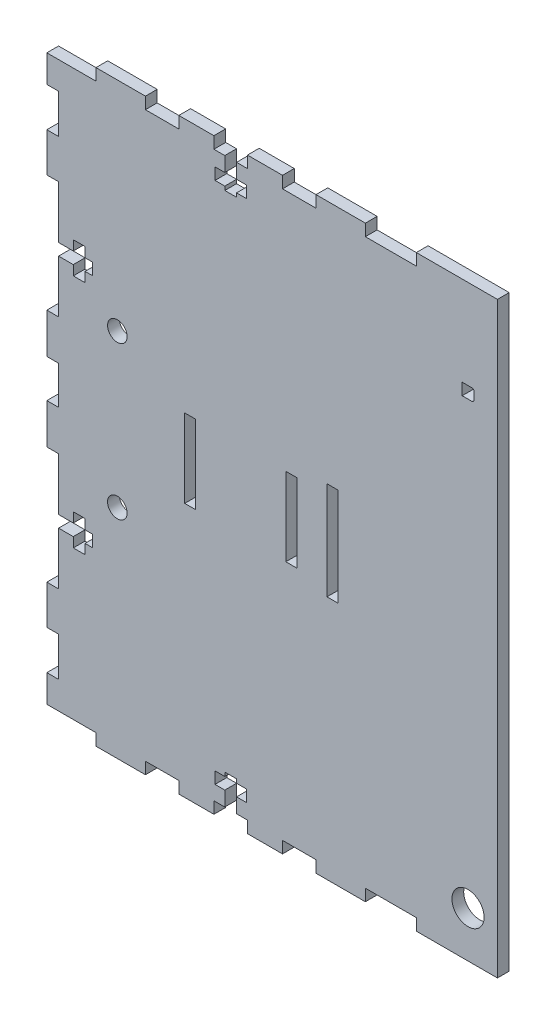
from build123d import *

# Parameters (mm, degrees)
SALIENTE_EXTRUIR1_DEPTH = 1.5
CROQUIS2_W              = 2.8
CROQUIS2_H              = 20
CROQUIS2_R              = 2.5
CORTAR_EXTRUIR1_DEPTH   = 11
CROQUIS4_W              = 2.8
CROQUIS4_H              = 25
CORTAR_EXTRUIR3_DEPTH   = 13
CROQUIS5_W              = 3
CROQUIS5_H              = 144.0002072
SALIENTE_EXTRUIR2_DEPTH = 15
CROQUIS6_R              = 4.1
CORTAR_EXTRUIR4_DEPTH   = 15
CROQUIS7_W              = 20.699997517
CROQUIS7_H              = 3
SALIENTE_EXTRUIR3_DEPTH = 3
CROQUIS8_W              = 20.699997553
CROQUIS8_H              = 3
SALIENTE_EXTRUIR4_DEPTH = 3


with BuildPart() as part:
    # Croquis1 → Saliente-Extruir1 (new, symmetric)
    with BuildSketch(Plane.XY):
        Polygon((419.401663173, 255.63715478), (419.401663173, 248.637154823), (431.940346335, 248.637154823), (431.940346335, 245.637154782), (444.561007707, 245.63714943), (444.561007707, 248.637149514), (453.092348458, 248.637149514), (453.092348458, 245.637149514), (462.042348456, 245.637149514), (462.042348456, 248.637116576), (464.821999726, 248.637116576), (464.821999726, 252.386767599), (462.321999727, 252.386767599), (462.321999727, 255.387116575), (464.821999726, 255.387116575), (464.821999726, 256.362116575), (467.821999725, 256.362116575), (467.821999725, 255.387116575), (470.322418497, 255.387116575), (470.322418497, 252.386767599), (467.821999725, 252.386767599), (467.821999725, 248.637116576), (470.601650995, 248.637116576), (470.601650995, 245.637116577), (479.551650993, 245.637116577), (479.551650993, 248.637039563), (488.101650991, 248.637039563), (488.101650991, 245.637039564), (500.701660131, 245.637039564), (500.701660131, 248.637051166), (519.401657648, 248.637051166), (519.401657648, 392.637258366), (500.701660095, 392.637258366), (500.701660095, 395.637269968), (488.101650956, 395.637269968), (488.101650956, 392.637269969), (479.551650957, 392.637269969), (479.551650957, 395.637192955), (470.601650959, 395.637192955), (470.601650959, 392.637192956), (467.82199969, 392.637192956), (467.82199969, 388.887541933), (470.322418461, 388.887541933), (470.322418461, 385.887192957), (467.82199969, 385.887192957), (467.82199969, 384.912192957), (464.82199969, 384.912192957), (464.82199969, 385.887192957), (462.321999691, 385.887192957), (462.321999691, 388.887541933), (464.82199969, 388.887541933), (464.82199969, 392.637192956), (462.04234842, 392.637192956), (462.04234842, 395.637160018), (453.092348422, 395.637160018), (453.092348422, 392.637160018), (444.561007671, 392.637160018), (444.561007671, 395.637160103), (431.9403463, 395.637154751), (431.9403463, 392.637154709), (419.401663173, 392.637154709), (419.401663173, 385.637154752), (422.401663173, 385.637154752), (422.401663173, 375.637154754), (419.401663173, 375.637154754), (419.401663173, 365.637154757), (422.401663173, 365.637154757), (422.401663173, 352.199445373), (426.151314195, 352.199445373), (426.151314195, 354.699864145), (429.151663171, 354.699864145), (429.151663171, 352.199445373), (431.101663171, 352.199445373), (431.101663171, 349.199445374), (429.151663171, 349.199445374), (429.151663171, 346.699445374), (426.151314195, 346.699445374), (426.151314195, 349.199445374), (422.401663173, 349.199445374), (422.401663173, 335.762154763), (419.401663173, 335.762154763), (419.401663173, 325.512154765), (422.401663173, 325.512154765), (422.401663173, 315.762154767), (419.401663173, 315.762154767), (419.401663173, 305.512154769), (422.401663173, 305.512154769), (422.401663173, 292.074445386), (426.151314195, 292.074445386), (426.151314195, 294.574864158), (429.151663171, 294.574864158), (429.151663171, 292.074445386), (431.101663171, 292.074445386), (431.101663171, 289.074445387), (429.151663171, 289.074445387), (429.151663171, 286.574445387), (426.151314195, 286.574445387), (426.151314195, 289.074445387), (422.401663173, 289.074445387), (422.401663173, 275.637154776), (419.401663173, 275.637154776), (419.401663173, 265.637154778), (422.401663173, 265.637154778), (422.401663173, 255.63715478), align=None)
    extrude(amount=SALIENTE_EXTRUIR1_DEPTH, both=True)

    # Croquis2 → Cortar-Extruir1 (cut)
    with BuildSketch(Plane.XY.offset(1.5)):
        with Locations((481.801663173, 320.637154766)):
            Rectangle(CROQUIS2_W, CROQUIS2_H)
        with Locations((456.001663173, 320.637154766)):
            Rectangle(CROQUIS2_W, CROQUIS2_H)
        with Locations((437.401663173, 340.137154766)):
            Circle(CROQUIS2_R)
        with Locations((437.401663173, 301.137154766)):
            Circle(CROQUIS2_R)
    extrude(amount=-CORTAR_EXTRUIR1_DEPTH, mode=Mode.SUBTRACT)

    # Croquis4 → Cortar-Extruir3 (cut)
    with BuildSketch(Plane(origin=(0, 0, -1.5), x_dir=(-1, 0, 0), z_dir=(0, 0, -1))):
        with Locations((-492.30166041, 320.637154766)):
            Rectangle(CROQUIS4_W, CROQUIS4_H)
    extrude(amount=-CORTAR_EXTRUIR3_DEPTH, mode=Mode.SUBTRACT)

    # Croquis5 → Saliente-Extruir2 (add)
    with BuildSketch(Plane(origin=(519.401657648, 0, 0), x_dir=(0, 0, -1), z_dir=(1, 0, 0))):
        with Locations((0, 320.637154766)):
            Rectangle(CROQUIS5_W, CROQUIS5_H)
    extrude(amount=SALIENTE_EXTRUIR2_DEPTH)

    # Croquis6 → Cortar-Extruir4 (cut)
    with BuildSketch(Plane.XY.offset(1.5)):
        with Locations((526.901657648, 257.337051166)):
            Circle(CROQUIS6_R)
        with BuildLine():
            Line((525.401657648, 369.837051166), (527.901657648, 369.837051166))
            ThreePointArc((527.901657648, 369.837051166), (528.255211039, 369.983497775), (528.401657648, 370.337051166))
            Line((528.401657648, 370.337051166), (528.401657648, 372.337051166))
            ThreePointArc((528.401657648, 372.337051166), (528.255211039, 372.690604556), (527.901657648, 372.837051166))
            Line((527.901657648, 372.837051166), (525.401657648, 372.837051166))
            Line((525.401657648, 372.837051166), (525.401657648, 369.837051166))
        make_face()
    extrude(amount=-CORTAR_EXTRUIR4_DEPTH, mode=Mode.SUBTRACT)

    # Croquis7 → Saliente-Extruir3 (add)
    with BuildSketch(Plane.XZ.offset(-248.637051166)):
        with Locations((524.05165889, 0)):
            Rectangle(CROQUIS7_W, CROQUIS7_H)
    extrude(amount=SALIENTE_EXTRUIR3_DEPTH)

    # Croquis8 → Saliente-Extruir4 (add)
    with BuildSketch(Plane(origin=(0, 392.637258366, 0), x_dir=(1, 0, 0), z_dir=(0, 1, 0))):
        with Locations((524.051658872, 0)):
            Rectangle(CROQUIS8_W, CROQUIS8_H)
    extrude(amount=SALIENTE_EXTRUIR4_DEPTH)


solid = part.part
